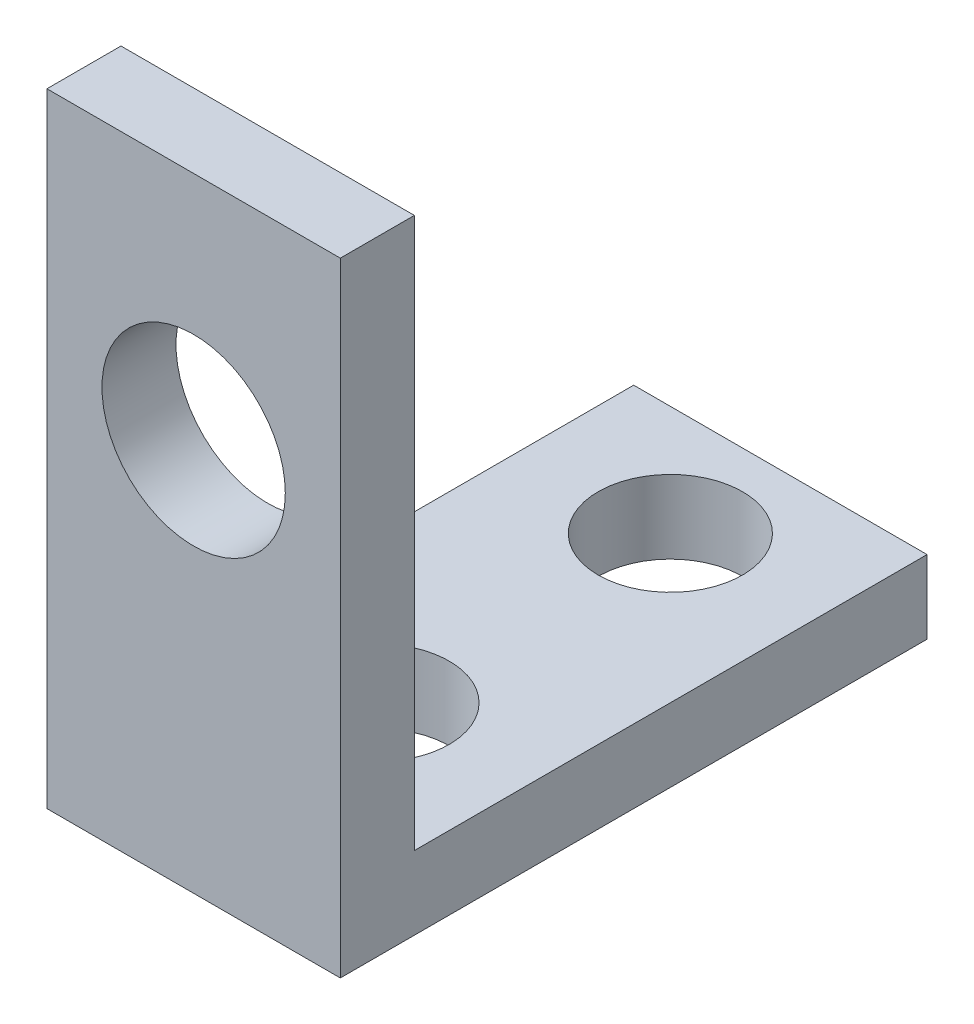
from build123d import *

# Parameters (mm, degrees)
SKETCH1_W           = 10.16
SKETCH1_H           = 20.32
SKETCH1_R           = 2.50063
BOSS_EXTRUDE1_DEPTH = 2.54
SKETCH2_W           = 10.16
SKETCH2_H           = 2.564193751
BOSS_EXTRUDE2_DEPTH = 19.05
SKETCH3_R           = 3.175
CUT_EXTRUDE1_DEPTH  = 2.564193751


with BuildPart() as part:
    # Sketch1 → Boss-Extrude1 (new body)
    with BuildSketch(Plane(origin=(0, 0, 0), x_dir=(1, 0, 0), z_dir=(0, 1, 0))):
        Rectangle(SKETCH1_W, SKETCH1_H)
        with Locations(Location((0, 6.35, 0), (0, 0, 270))):
            Circle(SKETCH1_R, mode=Mode.SUBTRACT)
        with Locations(Location((0, -3.81, 0), (0, 0, 270))):
            Circle(SKETCH1_R, mode=Mode.SUBTRACT)
    extrude(amount=BOSS_EXTRUDE1_DEPTH)

    # Sketch2 → Boss-Extrude2 (add)
    with BuildSketch(Plane(origin=(0, 2.54, 0), x_dir=(1, 0, 0), z_dir=(0, 1, 0))):
        with Locations((0, -8.877903125)):
            Rectangle(SKETCH2_W, SKETCH2_H)
    extrude(amount=BOSS_EXTRUDE2_DEPTH)

    # Sketch3 → Cut-Extrude1 (cut)
    with BuildSketch(Plane.XY.offset(10.16)):
        with Locations((0, 13.589)):
            Circle(SKETCH3_R)
    extrude(amount=-CUT_EXTRUDE1_DEPTH, mode=Mode.SUBTRACT)


solid = part.part
